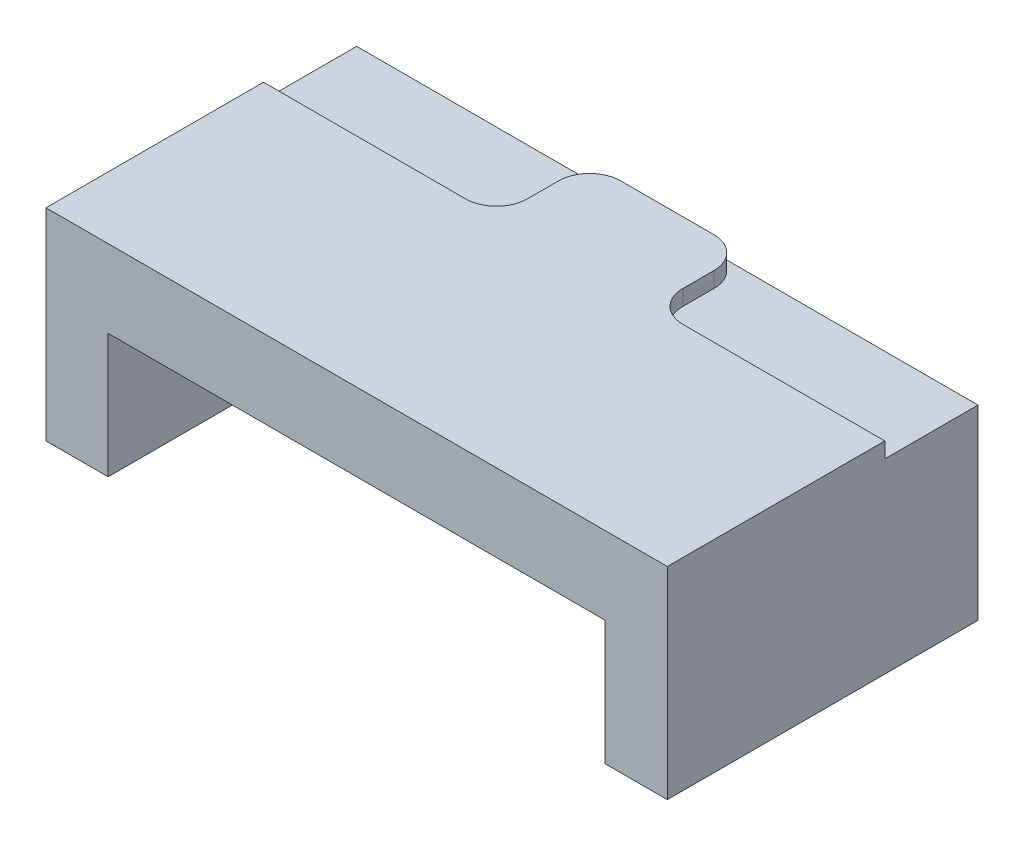
from build123d import *

# Parameters (mm, degrees)
BOSS_EXTRUDE1_DEPTH = 100
SKETCH2_W           = 50
SKETCH2_H           = 30
BOSS_EXTRUDE2_DEPTH = 5
FILLET1_R           = 10
SCALE1_SCALE        = 10


with BuildPart() as part:
    # Sketch1 → Boss-Extrude1 (new body)
    with BuildSketch(Plane.XY):
        Polygon((0, 60), (-100, 60), (-100, 0), (-80, 0), (-80, 40), (0, 40), align=None)
    boss_extrude1 = extrude(amount=BOSS_EXTRUDE1_DEPTH)

    # Mirror1: Boss-Extrude1 across plane
    add(boss_extrude1.mirror(Plane(origin=(0, 40, 100), x_dir=(0, 0, 1), z_dir=(-1, 0, 0))))

    # Sketch2 → Boss-Extrude2 (add)
    with BuildSketch(Plane(origin=(0, 60, 0), x_dir=(1, 0, 0), z_dir=(0, 1, 0))):
        Polygon((-100, -30), (-100, -100), (100, -100), (100, -30), (25, -30), (-25, -30), align=None)
        with Locations((0, -15)):
            Rectangle(SKETCH2_W, SKETCH2_H)
    extrude(amount=BOSS_EXTRUDE2_DEPTH)

    # Fillet1
    fillet1_edges = [part.edges().sort_by_distance(p)[0] for p in [
        (-25, 62.5, 30),
        (25, 62.5, 30),
        (25, 62.5, 0),
        (-25, 62.5, 0),
    ]]
    fillet(fillet1_edges, radius=FILLET1_R)


with BuildPart() as part_1:
    # Scale1: scaled about (0, 43.990196078, 51.243889179)
    add(part.part.scale(SCALE1_SCALE).moved(Location((0, -395.911764702, -461.195002611))))


solid = part_1.part
